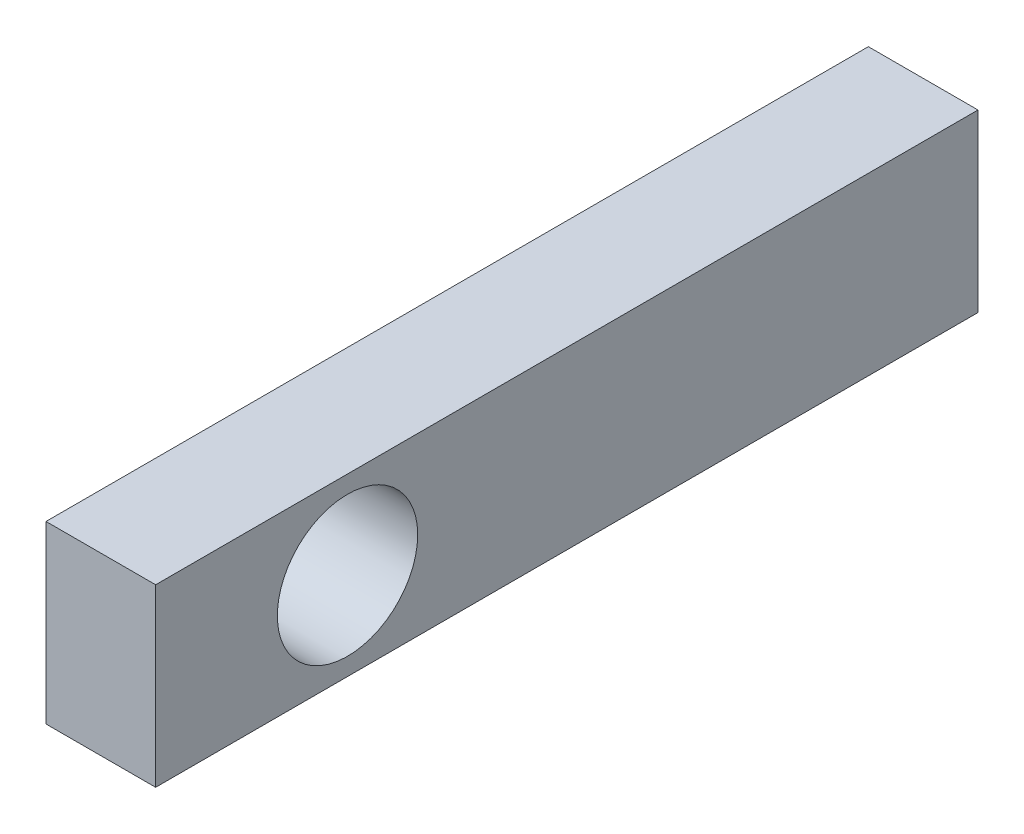
from build123d import *

# Parameters (mm, degrees)
BASE_MOUNTED_START            = 27
SKETCH1_W                     = 4
SKETCH1_H                     = 6.4
BASE_MOUNTED_STOP_BLOCK_DEPTH = 30
SKETCH2_R                     = 2.56
M6_TAP_CORE_DEPTH             = 4


with BuildPart() as part:
    # Sketch1 → Base-mounted stop block (new body)
    with BuildSketch(Plane.XY.offset(BASE_MOUNTED_START)):
        with Locations((2, 80.8)):
            Rectangle(SKETCH1_W, SKETCH1_H)
    extrude(amount=BASE_MOUNTED_STOP_BLOCK_DEPTH)

    # Sketch2 → M6 tap core (cut)
    with BuildSketch(Plane(origin=(0, 0, 0), x_dir=(0, 0, -1), z_dir=(1, 0, 0))):
        with Locations((-50, 80.8)):
            Circle(SKETCH2_R)
    extrude(amount=M6_TAP_CORE_DEPTH, mode=Mode.SUBTRACT)


solid = part.part
